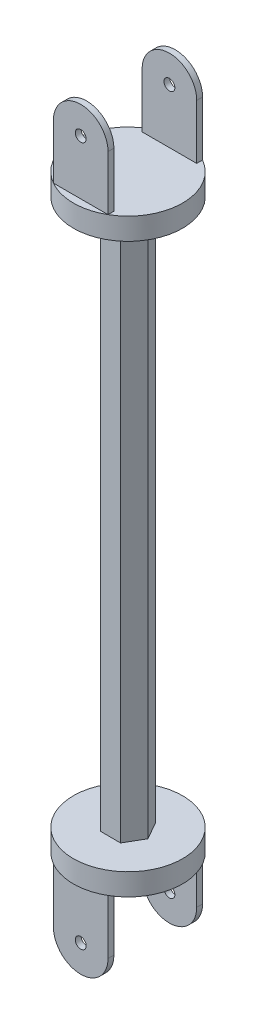
from build123d import *

# Parameters (mm, degrees)
BOSS_EXTRUDE1_DEPTH = 100
SKETCH3_R           = 10
BOSS_EXTRUDE2_DEPTH = 4
SKETCH5_W           = 10
SKETCH5_H           = 1.075357982
BOSS_EXTRUDE3_DEPTH = 15
FILLET3_RADIUS      = 5
FILLET3_LENGTH      = 1.075357982
FILLET4_RADIUS      = 5
FILLET4_LENGTH      = 1.075357982
CUT_EXTRUDE1_REACH  = 122.869
SKETCH6_R           = 1


with BuildPart() as part:
    # Sketch2 → Boss-Extrude1 (new body)
    with BuildSketch(Plane(origin=(0, 0, 0), x_dir=(1, 0, 0), z_dir=(0, 1, 0))):
        Polygon((1.843695467, 3.168851584), (-1.822458239, 3.181112903), (-3.666153706, 0.012261319), (-1.843695467, -3.168851584), (1.822458239, -3.181112903), (3.666153706, -0.012261319), align=None)
    extrude(amount=BOSS_EXTRUDE1_DEPTH)

    # Sketch3 → Boss-Extrude2 (add)
    with BuildSketch(Plane(origin=(0, 100, 0), x_dir=(1, 0, 0), z_dir=(0, 1, 0))):
        with Locations(Location((0, 0, 0), (0, 0, 270))):
            Circle(SKETCH3_R)
    extrude(amount=BOSS_EXTRUDE2_DEPTH)

    # Sketch5 → Boss-Extrude3 (add)
    with BuildSketch(Plane(origin=(0, 104, 0), x_dir=(1, 0, 0), z_dir=(0, 1, 0))):
        with Locations((0, 8.122575047)):
            Rectangle(SKETCH5_W, SKETCH5_H)
        with Locations((0, -8.122575047)):
            Rectangle(SKETCH5_W, SKETCH5_H)
    extrude(amount=BOSS_EXTRUDE3_DEPTH)

    # Fillet3: full round fillet: the end face becomes a half cylinder, R = half its width
    fillet3_face = Plane((0, 119, 8.122575047), x_dir=(0, 0, -1), z_dir=(0, 1, 0))  # on the end face: x along it, z out of the body
    fillet3_slab = fillet3_face.offset(-FILLET3_RADIUS / 2) * Box(FILLET3_LENGTH, 2 * FILLET3_RADIUS, FILLET3_RADIUS, mode=Mode.PRIVATE)  # the body's end, R deep
    fillet3_round = Plane((0, 114, 8.122575047), x_dir=(0, 1, 0), z_dir=(0, 0, -1)) * Cylinder(FILLET3_RADIUS, FILLET3_LENGTH, mode=Mode.PRIVATE)  # its axis R under the face
    add(fillet3_slab - fillet3_round, mode=Mode.SUBTRACT)

    # Fillet4: full round fillet: the end face becomes a half cylinder, R = half its width
    fillet4_face = Plane((0, 119, -8.122575047), x_dir=(0, 0, 1), z_dir=(0, 1, 0))  # on the end face: x along it, z out of the body
    fillet4_slab = fillet4_face.offset(-FILLET4_RADIUS / 2) * Box(FILLET4_LENGTH, 2 * FILLET4_RADIUS, FILLET4_RADIUS, mode=Mode.PRIVATE)  # the body's end, R deep
    fillet4_round = Plane((0, 114, -8.122575047), x_dir=(0, 1, 0), z_dir=(0, 0, 1)) * Cylinder(FILLET4_RADIUS, FILLET4_LENGTH, mode=Mode.PRIVATE)  # its axis R under the face
    add(fillet4_slab - fillet4_round, mode=Mode.SUBTRACT)

    # Cut-Extrude1: up to this face of the body (flat: up to its plane)
    cut_extrude1_end = Plane(part.part.faces().sort_by_distance((0, 111.008207501, -8.660254038))[0])
    # Sketch6 → Cut-Extrude1 (cut, up to the picked face)
    with BuildSketch(Plane.XY.offset(8.660254038), mode=Mode.PRIVATE) as cut_extrude1_sk1:
        with Locations((0, 114)):
            Circle(SKETCH6_R)
    cut_extrude1_tool1 = split(extrude(cut_extrude1_sk1.sketch, amount=-CUT_EXTRUDE1_REACH, mode=Mode.PRIVATE), bisect_by=cut_extrude1_end, keep=Keep.BOTH, mode=Mode.PRIVATE)
    add(cut_extrude1_tool1.solids().sort_by(Axis((0, 114, 8.660254), (0, 0, -1)))[0], mode=Mode.SUBTRACT)

    # Mirror1: part across plane


with BuildPart() as part_1:
    add(part.part)
    add(part.part.mirror(Plane(origin=(0, 50, 0), x_dir=(0, 0, 1), z_dir=(0, -1, 0))))


solid = part_1.part
